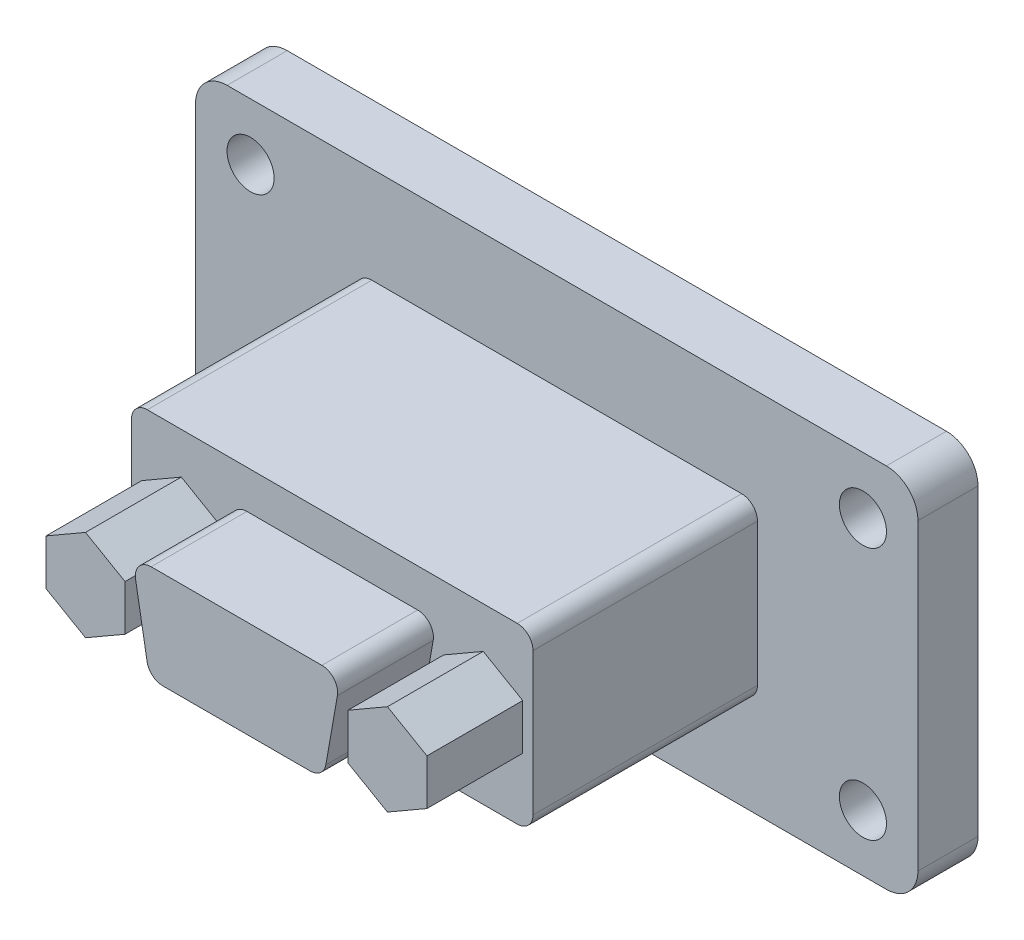
from build123d import *

# Parameters (mm, degrees)
SKETCH1_W                       = 58.039
SKETCH1_H                       = 29.464
BOSS_EXTRUDE1_DEPTH             = 4.826
F_25_0_1495_DIAMETER_HOLE1_D    = 3.7846
SKETCH4_W                       = 32.258
SKETCH4_H                       = 13.97
BOSS_EXTRUDE2_DEPTH             = 18.034
FILLET1_R                       = 2.54
FILLET2_R                       = 1.27
BOSS_EXTRUDE3_DEPTH             = 7.6962
BOSS_EXTRUDE3_DEPTH_BACK        = 30.5562
BOSS_EXTRUDE4_REACH             = 46.641
BOSS_EXTRUDE4_DIRECTION_2_REACH = 46.641


with BuildPart() as part:
    # Sketch1 → Boss-Extrude1 (new body)
    with BuildSketch(Plane.XY):
        Rectangle(SKETCH1_W, SKETCH1_H)
    extrude(amount=BOSS_EXTRUDE1_DEPTH)

    # #25 (0.1495) Diameter Hole1 (through all)
    with Locations(Plane.XY.offset(4.826)):
        with Locations((-24.5999, 10.16), (24.5999, 10.16), (24.5999, -10.16), (-24.5999, -10.16)):
            Hole(F_25_0_1495_DIAMETER_HOLE1_D / 2)

    # Sketch4 → Boss-Extrude2 (add)
    with BuildSketch(Plane.XY.offset(4.826)):
        Rectangle(SKETCH4_W, SKETCH4_H)
    extrude(amount=BOSS_EXTRUDE2_DEPTH)

    # Fillet1
    fillet1_edges = [part.edges().sort_by_distance(p)[0] for p in [
        (29.0195, -14.732, 2.413),
        (-29.0195, -14.732, 2.413),
        (-29.0195, 14.732, 2.413),
        (29.0195, 14.732, 2.413),
    ]]
    fillet(fillet1_edges, radius=FILLET1_R)

    # Fillet2
    fillet2_edges = [part.edges().sort_by_distance(p)[0] for p in [
        (16.129, -6.985, 13.843),
        (16.129, 6.985, 13.843),
        (-16.129, 6.985, 13.843),
        (-16.129, -6.985, 13.843),
    ]]
    fillet(fillet2_edges, radius=FILLET2_R)

    # Sketch5 → Boss-Extrude3 (add, two sides: drawn at the far end of the back side and taken through both)
    with BuildSketch(Plane.XY.offset(22.86).offset(-BOSS_EXTRUDE3_DEPTH_BACK)):
        with BuildLine():
            Line((8.108705846, 2.421066814), (7.177135142, -2.862133186))
            ThreePointArc((7.177135142, -2.862133186), (6.74276956, -3.614476443), (5.926429296, -3.9116))
            Line((5.926429296, -3.9116), (-5.926429296, -3.9116))
            ThreePointArc((-5.926429296, -3.9116), (-6.74276956, -3.614476443), (-7.177135142, -2.862133186))
            Line((-7.177135142, -2.862133186), (-8.108705846, 2.421066814))
            ThreePointArc((-8.108705846, 2.421066814), (-7.830876443, 3.457940264), (-6.858, 3.9116))
            Line((-6.858, 3.9116), (6.858, 3.9116))
            ThreePointArc((6.858, 3.9116), (7.830876443, 3.457940264), (8.108705846, 2.421066814))
        make_face()
    extrude(amount=BOSS_EXTRUDE3_DEPTH + BOSS_EXTRUDE3_DEPTH_BACK)

    # Boss-Extrude4: up to this face of the body (flat: up to its plane)
    boss_extrude4_end = Plane(part.part.faces().sort_by_distance((0, 0.101689946, 30.5562))[0])
    # Sketch6 → Boss-Extrude4 (add, up to the picked face)
    with BuildSketch(Plane.XY.offset(22.86), mode=Mode.PRIVATE) as boss_extrude4_sk1:
        Polygon((12.1285, -3.666174209), (15.3035, -1.833087105), (15.3035, 1.833087105), (12.1285, 3.666174209), (8.9535, 1.833087105), (8.9535, -1.833087105), align=None)
    boss_extrude4_tool1 = split(extrude(boss_extrude4_sk1.sketch, amount=BOSS_EXTRUDE4_REACH, mode=Mode.PRIVATE), bisect_by=boss_extrude4_end, keep=Keep.BOTH, mode=Mode.PRIVATE)
    # Sketch6 → Boss-Extrude4 (add, up to the picked face)
    with BuildSketch(Plane.XY.offset(22.86), mode=Mode.PRIVATE) as boss_extrude4_sk2:
        Polygon((-12.1285, -3.666174209), (-8.9535, -1.833087105), (-8.9535, 1.833087105), (-12.1285, 3.666174209), (-15.3035, 1.833087105), (-15.3035, -1.833087105), align=None)
    boss_extrude4_tool2 = split(extrude(boss_extrude4_sk2.sketch, amount=BOSS_EXTRUDE4_REACH, mode=Mode.PRIVATE), bisect_by=boss_extrude4_end, keep=Keep.BOTH, mode=Mode.PRIVATE)
    add(boss_extrude4_tool1.solids().sort_by(Axis((12.1285, 0, 22.86), (0, 0, 1)))[0])
    add(boss_extrude4_tool2.solids().sort_by(Axis((-12.1285, 0, 22.86), (0, 0, 1)))[0])

    # Boss-Extrude4 direction 2: up to this face of the body (flat: up to its plane)
    boss_extrude4_direction_2_end = Plane(part.part.faces().sort_by_distance((0, 0.101689946, -7.6962))[0])
    # Sketch6 → Boss-Extrude4 direction 2 (add, up to the picked face)
    with BuildSketch(Plane.XY.offset(22.86), mode=Mode.PRIVATE) as boss_extrude4_direction_2_sk1:
        Polygon((12.1285, -3.666174209), (15.3035, -1.833087105), (15.3035, 1.833087105), (12.1285, 3.666174209), (8.9535, 1.833087105), (8.9535, -1.833087105), align=None)
    boss_extrude4_direction_2_tool1 = split(extrude(boss_extrude4_direction_2_sk1.sketch, amount=-BOSS_EXTRUDE4_DIRECTION_2_REACH, mode=Mode.PRIVATE), bisect_by=boss_extrude4_direction_2_end, keep=Keep.BOTH, mode=Mode.PRIVATE)
    # Sketch6 → Boss-Extrude4 direction 2 (add, up to the picked face)
    with BuildSketch(Plane.XY.offset(22.86), mode=Mode.PRIVATE) as boss_extrude4_direction_2_sk2:
        Polygon((-12.1285, -3.666174209), (-8.9535, -1.833087105), (-8.9535, 1.833087105), (-12.1285, 3.666174209), (-15.3035, 1.833087105), (-15.3035, -1.833087105), align=None)
    boss_extrude4_direction_2_tool2 = split(extrude(boss_extrude4_direction_2_sk2.sketch, amount=-BOSS_EXTRUDE4_DIRECTION_2_REACH, mode=Mode.PRIVATE), bisect_by=boss_extrude4_direction_2_end, keep=Keep.BOTH, mode=Mode.PRIVATE)
    add(boss_extrude4_direction_2_tool1.solids().sort_by(Axis((12.1285, 0, 22.86), (0, 0, -1)))[0])
    add(boss_extrude4_direction_2_tool2.solids().sort_by(Axis((-12.1285, 0, 22.86), (0, 0, -1)))[0])


solid = part.part
